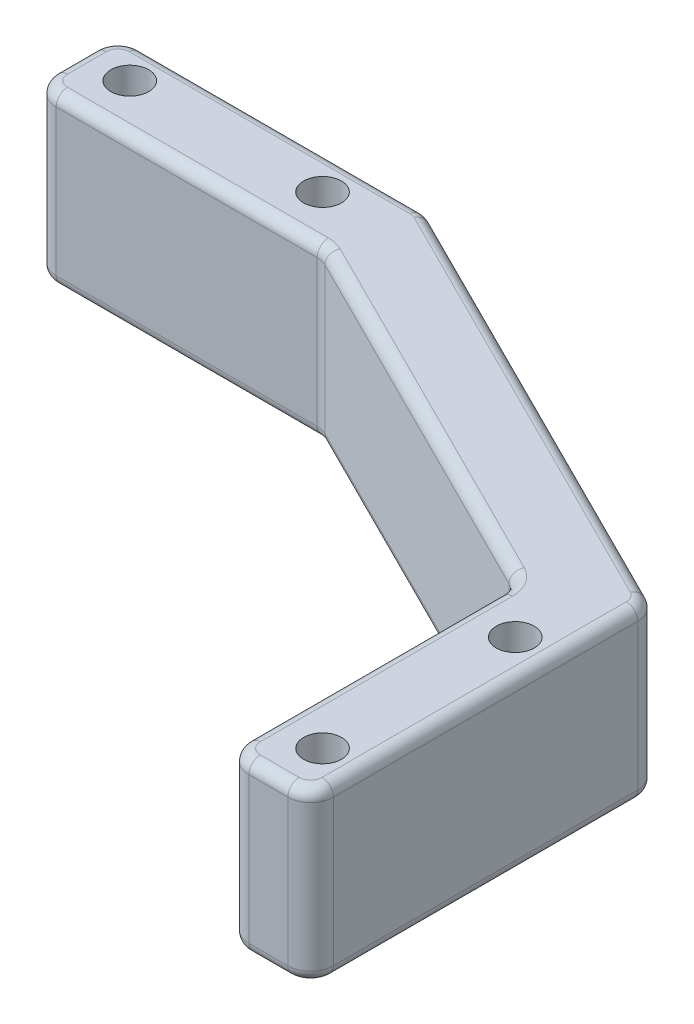
from build123d import *

# Parameters (mm, degrees)
SKETCH1_W           = 38.1
SKETCH1_H           = 11.1252
SKETCH1_R           = 2.5
SKETCH1_W_2         = 11.1252
SKETCH1_H_2         = 38.1
BOSS_EXTRUDE1_DEPTH = 22.2504
FILLET1_R           = 3
FILLET2_R           = 1.5


with BuildPart() as part:
    # Sketch1 → Boss-Extrude1 (new body)
    # profile 1 of 3: a face of its own
    with BuildSketch(Plane(origin=(0, 0, 0), x_dir=(1, 0, 0), z_dir=(0, 1, 0))):
        with Locations((19.05, -5.5626)):
            Rectangle(SKETCH1_W, SKETCH1_H)
        with Locations(Location((6.35, -4.7752, 0), (0, 0, 90))):
            Circle(SKETCH1_R, mode=Mode.SUBTRACT)
        with Locations(Location((31.75, -4.7752, 0), (0, 0, 90))):
            Circle(SKETCH1_R, mode=Mode.SUBTRACT)
    # profile 2 of 3: a face of its own
    with BuildSketch(Plane(origin=(0, 0, 0), x_dir=(1, 0, 0), z_dir=(0, 1, 0))):
        Polygon((100.0252, -29.649448268), (100.0252, -36.5252), (88.9, -36.5252), (38.1, -11.1252), (38.1, 0), (40.726303463, 0), align=None)
    # profile 3 of 3: a face of its own
    with BuildSketch(Plane(origin=(0, 0, 0), x_dir=(1, 0, 0), z_dir=(0, 1, 0))):
        with Locations((94.4626, -55.5752)):
            Rectangle(SKETCH1_W_2, SKETCH1_H_2)
        with Locations(Location((95.25, -68.2752, 0), (0, 0, 90))):
            Circle(SKETCH1_R, mode=Mode.SUBTRACT)
        with Locations(Location((95.25, -42.8752, 0), (0, 0, 90))):
            Circle(SKETCH1_R, mode=Mode.SUBTRACT)
    extrude(amount=BOSS_EXTRUDE1_DEPTH)

    # Fillet1
    fillet1_edges = [part.edges().sort_by_distance(p)[0] for p in [
        (0, 11.1252, 11.1252),
        (0, 11.1252, 0),
        (40.726303463, 11.1252, 0),
        (100.0252, 11.1252, 29.649448268),
        (100.0252, 11.1252, 74.6252),
        (88.9, 11.1252, 74.6252),
        (88.9, 11.1252, 36.5252),
        (38.1, 11.1252, 11.1252),
    ]]
    fillet(fillet1_edges, radius=FILLET1_R)

    # Fillet2
    fillet2_edges = [part.edges().sort_by_distance(p)[0] for p in [
        (21.509049765, 0, 0),
        (21.509049765, 22.2504, 0),
        (20.195898034, 0, 11.1252),
        (0, 0, 5.5626),
        (69.863290552, 0, 14.568493544),
        (100.0252, 0, 51.564375117),
        (94.4626, 0, 74.6252),
        (88.9, 0, 55.002250983),
        (62.98753882, 0, 23.56896941),
        (0.878679656, 0, 0.878679656),
        (0.878679656, 0, 10.246520344),
        (89.778679656, 0, 73.746520344),
        (99.146520344, 0, 73.746520344),
        (99.577152425, 0, 29.926356898),
        (40.707358292, 0, 0.080253032),
        (69.863290552, 22.2504, 14.568493544),
        (20.195898034, 22.2504, 11.1252),
        (62.98753882, 22.2504, 23.56896941),
        (88.9, 22.2504, 55.002250983),
        (94.4626, 22.2504, 74.6252),
        (100.0252, 22.2504, 51.564375117),
        (0, 22.2504, 5.5626),
        (0.878679656, 22.2504, 0.878679656),
        (0.878679656, 22.2504, 10.246520344),
        (89.778679656, 22.2504, 73.746520344),
        (99.146520344, 22.2504, 73.746520344),
        (99.577152425, 22.2504, 29.926356898),
        (40.707358292, 22.2504, 0.080253032),
        (38.081054829, 0, 11.205453032),
        (38.081054829, 22.2504, 11.205453032),
        (88.451952425, 0, 36.80210863),
        (88.451952425, 22.2504, 36.80210863),
    ]]
    fillet(fillet2_edges, radius=FILLET2_R)


solid = part.part
